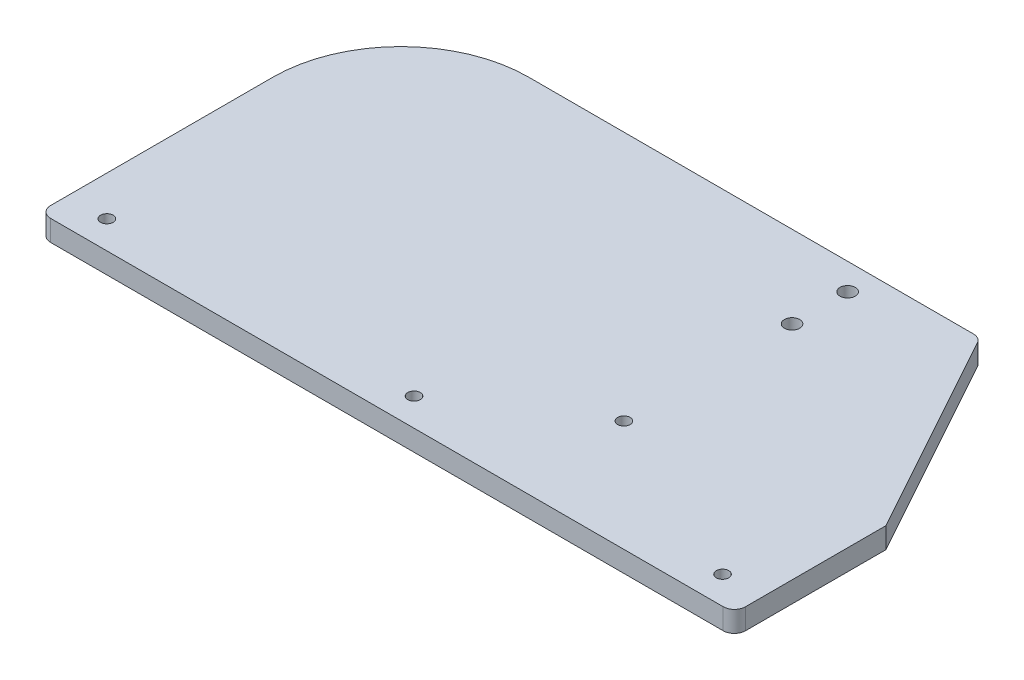
from build123d import *

# Parameters (mm, degrees)
SKETCH1_R           = 2.25
SKETCH1_R_2         = 2.75
BOSS_EXTRUDE1_DEPTH = 7.5


with BuildPart() as part:
    # Sketch1 → Boss-Extrude1 (new body)
    with BuildSketch(Plane(origin=(0, 0, 0), x_dir=(1, 0, 0), z_dir=(0, 1, 0))):
        with BuildLine():
            Line((-166.25, -10), (75.75, -10))
            ThreePointArc((75.75, -10), (78.578427125, -8.828427125), (79.75, -6))
            Line((79.75, -6), (79.75, 44.5))
            Line((79.75, 44.5), (39.252647377, 117.931699085))
            ThreePointArc((39.252647377, 117.931699085), (37.783863769, 119.444328406), (35.75, 120))
            Line((35.75, 120), (-124.25, 120))
            ThreePointArc((-124.25, 120), (-156.776911935, 106.526911935), (-170.25, 74))
            Line((-170.25, 74), (-170.25, -6))
            ThreePointArc((-170.25, -6), (-169.078427125, -8.828427125), (-166.25, -10))
        make_face()
        with Locations(Location((65.5, 0, 0), (0, 0, 270))):
            Circle(SKETCH1_R, mode=Mode.SUBTRACT)
        with Locations(Location((-45.5, 0, 0), (0, 0, 270))):
            Circle(SKETCH1_R, mode=Mode.SUBTRACT)
        with Locations(Location((-156, 0, 0), (0, 0, 270))):
            Circle(SKETCH1_R, mode=Mode.SUBTRACT)
        with Locations(Location((0, 90.5, 0), (0, 0, 270))):
            Circle(SKETCH1_R_2, mode=Mode.SUBTRACT)
        with Locations(Location((0, 110.5, 0), (0, 0, 270))):
            Circle(SKETCH1_R_2, mode=Mode.SUBTRACT)
        with Locations(Location((0, 30, 0), (0, 0, 270))):
            Circle(SKETCH1_R, mode=Mode.SUBTRACT)
    extrude(amount=BOSS_EXTRUDE1_DEPTH)


solid = part.part
